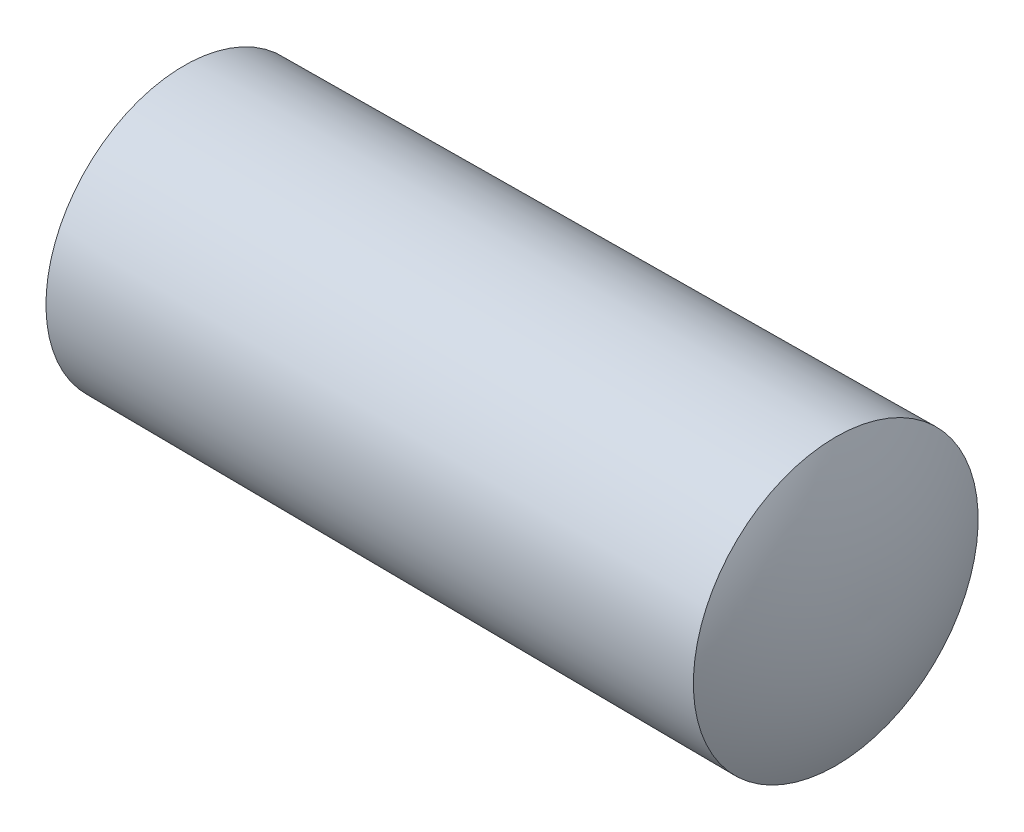
from build123d import *


with BuildPart() as part:
    # 草图1 → Revolve 520 (revolve)
    with BuildSketch(Plane.XY):
        with BuildLine():
            Line((0, 0), (26, 0))
            ThreePointArc((26, 0), (25.726158979, -2.653911805), (24.8, -5.156004192))
            Line((24.8, -5.156004192), (1.2, -5))
            ThreePointArc((1.2, -5), (0.273132168, -2.57844828), (0, 0))
        make_face()
    revolve(axis=Axis((0, 0, 0), (1, 0, 0)))


solid = part.part
